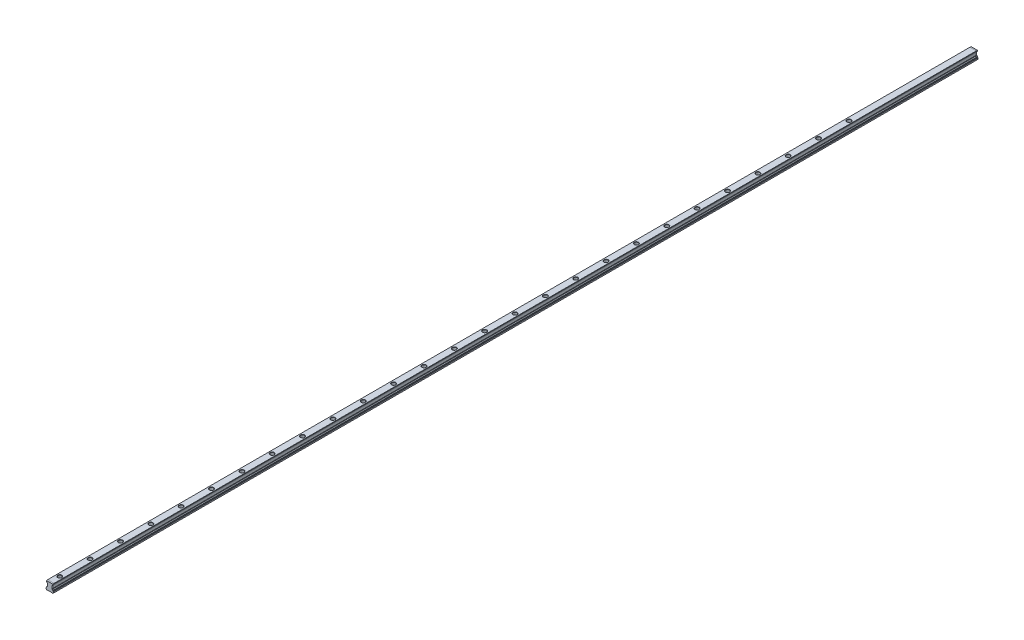
from build123d import *

# Parameters (mm, degrees)
BOSS_EXTRUDE1_DEPTH        = 911.5
BOSS_EXTRUDE2_DEPTH        = 2.5
BOSS_EXTRUDE2_DRAFT        = 7
MIRROR1_COPY_1_DEPTH       = 2.5
MIRROR1_COPY_1_DRAFT       = 7
SKETCH5_R                  = 2.25
CUT_EXTRUDE1_DEPTH         = 915.1754833
CHAMFER1_SIZE              = 0.5
LPATTERN1_COUNT            = 27
LPATTERN1_PITCH            = 60
CHAMFER1_OF_LPATTERN1_SIZE = 0.5
SKETCH6_R                  = 3.7
CUT_EXTRUDE2_DEPTH         = 5.9
CHAMFER2_SIZE              = 0.5
LPATTERN2_COUNT            = 27
LPATTERN2_PITCH            = 60
CHAMFER2_OF_LPATTERN2_SIZE = 0.5


with BuildPart() as part:
    # Sketch3 → Boss-Extrude1 (new, symmetric)
    with BuildSketch(Plane.XY):
        with BuildLine():
            Line((6.440305418, -7.679083745), (7.640305418, -6.479083745))
            Line((7.640305418, -6.479083745), (7.640305418, -3.983228934))
            Line((7.640305418, -3.983228934), (6.940305418, -3.579083745))
            Line((6.940305418, -3.579083745), (6.940305418, -2.064642509))
            ThreePointArc((6.940305418, -2.064642509), (6.075261245, -1.652952937), (5.584764336, -0.830029788))
            Line((5.584764336, -0.830029788), (4.890305418, -0.429083745))
            Line((4.890305418, -0.429083745), (4.890305418, 4.770916255))
            Line((4.890305418, 4.770916255), (5.584764336, 5.171862298))
            ThreePointArc((5.584764336, 5.171862298), (6.075261245, 5.994785446), (6.940305418, 6.406475019))
            Line((6.940305418, 6.406475019), (6.940305418, 8.025941508))
            Line((6.940305418, 8.025941508), (6.445330671, 8.520916255))
            Line((6.445330671, 8.520916255), (-6.164719835, 8.520916255))
            Line((-6.164719835, 8.520916255), (-6.659694582, 8.025941508))
            Line((-6.659694582, 8.025941508), (-6.659694582, 6.406475019))
            ThreePointArc((-6.659694582, 6.406475019), (-5.794650408, 5.994785446), (-5.304153499, 5.171862298))
            Line((-5.304153499, 5.171862298), (-4.609694582, 4.770916255))
            Line((-4.609694582, 4.770916255), (-4.609694582, -0.429083745))
            Line((-4.609694582, -0.429083745), (-5.304153499, -0.830029788))
            ThreePointArc((-5.304153499, -0.830029788), (-5.794650408, -1.652952937), (-6.659694582, -2.064642509))
            Line((-6.659694582, -2.064642509), (-6.659694582, -3.579083745))
            Line((-6.659694582, -3.579083745), (-7.359694582, -3.983228934))
            Line((-7.359694582, -3.983228934), (-7.359694582, -6.479083745))
            Line((-7.359694582, -6.479083745), (-6.159694582, -7.679083745))
            Line((-6.159694582, -7.679083745), (-3.159694582, -7.679083745))
            Line((-3.159694582, -7.679083745), (-2.859694582, -7.379083745))
            Line((-2.859694582, -7.379083745), (3.140305418, -7.379083745))
            Line((3.140305418, -7.379083745), (3.440305418, -7.679083745))
            Line((3.440305418, -7.679083745), (6.440305418, -7.679083745))
        make_face()
    extrude(amount=BOSS_EXTRUDE1_DEPTH, both=True)


with BuildPart() as boss_extrude2_tool:
    # Sketch4 → Boss-Extrude2 (with draft: the straight prism first)
    with BuildSketch(Plane.XY.offset(911.5)):
        with BuildLine():
            Line((6.440305418, -7.679083745), (7.640305418, -6.479083745))
            Line((7.640305418, -6.479083745), (7.640305418, -3.983228934))
            Line((7.640305418, -3.983228934), (6.940305418, -3.579083745))
            Line((6.940305418, -3.579083745), (6.940305418, -2.064642509))
            ThreePointArc((6.940305418, -2.064642509), (6.075261245, -1.652952937), (5.584764336, -0.830029788))
            Line((5.584764336, -0.830029788), (4.890305418, -0.429083745))
            Line((4.890305418, -0.429083745), (4.890305418, 4.770916255))
            Line((4.890305418, 4.770916255), (5.584764336, 5.171862298))
            ThreePointArc((5.584764336, 5.171862298), (6.075261245, 5.994785446), (6.940305418, 6.406475019))
            Line((6.940305418, 6.406475019), (6.940305418, 8.025941508))
            Line((6.940305418, 8.025941508), (6.445330671, 8.520916255))
            Line((6.445330671, 8.520916255), (-6.164719835, 8.520916255))
            Line((-6.164719835, 8.520916255), (-6.659694582, 8.025941508))
            Line((-6.659694582, 8.025941508), (-6.659694582, 6.406475019))
            ThreePointArc((-6.659694582, 6.406475019), (-5.794650408, 5.994785446), (-5.304153499, 5.171862298))
            Line((-5.304153499, 5.171862298), (-4.609694582, 4.770916255))
            Line((-4.609694582, 4.770916255), (-4.609694582, -0.429083745))
            Line((-4.609694582, -0.429083745), (-5.304153499, -0.830029788))
            ThreePointArc((-5.304153499, -0.830029788), (-5.794650408, -1.652952937), (-6.659694582, -2.064642509))
            Line((-6.659694582, -2.064642509), (-6.659694582, -3.579083745))
            Line((-6.659694582, -3.579083745), (-7.359694582, -3.983228934))
            Line((-7.359694582, -3.983228934), (-7.359694582, -6.479083745))
            Line((-7.359694582, -6.479083745), (-6.159694582, -7.679083745))
            Line((-6.159694582, -7.679083745), (-3.159694582, -7.679083745))
            Line((-3.159694582, -7.679083745), (-2.859694582, -7.379083745))
            Line((-2.859694582, -7.379083745), (3.140305418, -7.379083745))
            Line((3.140305418, -7.379083745), (3.440305418, -7.679083745))
            Line((3.440305418, -7.679083745), (6.440305418, -7.679083745))
        make_face()
    extrude(amount=BOSS_EXTRUDE2_DEPTH)
    # Boss-Extrude2: the draft: its side faces are tilted about the plane it starts from
    boss_extrude2_sides = [boss_extrude2_tool.faces().sort_by_distance(p)[0] for p in [
        (7.040305418, -7.079083745, 912.75),
        (7.640305418, -5.231156339, 912.75),
        (7.290305418, -3.781156339, 912.75),
        (6.940305418, -2.821863127, 912.75),
        (6.075261245, -1.652952937, 912.75),
        (5.237534877, -0.629556767, 912.75),
        (4.890305418, 2.170916255, 912.75),
        (5.237534877, 4.971389276, 912.75),
        (6.075261245, 5.994785446, 912.75),
        (6.940305418, 7.216208263, 912.75),
        (6.692818045, 8.273428881, 912.75),
        (0.140305418, 8.520916255, 912.75),
        (-6.412207208, 8.273428881, 912.75),
        (-6.659694582, 7.216208263, 912.75),
        (-5.794650408, 5.994785446, 912.75),
        (-4.95692404, 4.971389276, 912.75),
        (-4.609694582, 2.170916255, 912.75),
        (-4.95692404, -0.629556767, 912.75),
        (-5.794650408, -1.652952937, 912.75),
        (-6.659694582, -2.821863127, 912.75),
        (-7.009694582, -3.781156339, 912.75),
        (-7.359694582, -5.231156339, 912.75),
        (-6.759694582, -7.079083745, 912.75),
        (-4.659694582, -7.679083745, 912.75),
        (-3.009694582, -7.529083745, 912.75),
        (0.140305418, -7.379083745, 912.75),
        (3.290305418, -7.529083745, 912.75),
        (4.940305418, -7.679083745, 912.75),
    ]]
    draft(boss_extrude2_sides, Plane.XY.offset(911.5), BOSS_EXTRUDE2_DRAFT)


with BuildPart() as part_1:
    add(part.part)

    # Boss-Extrude2: add boss_extrude2_tool
    add(boss_extrude2_tool.part)


with BuildPart() as mirror1_copy_1_tool:
    # Mirror1 copy 1 sketch → Mirror1 copy 1 (with draft: the straight prism first)
    with BuildSketch(Plane(origin=(0, 0, -911.5), x_dir=(1, 0, 0), z_dir=(0, 0, -1))):
        with BuildLine():
            Line((6.440305418, 7.679083745), (7.640305418, 6.479083745))
            Line((7.640305418, 6.479083745), (7.640305418, 3.983228934))
            Line((7.640305418, 3.983228934), (6.940305418, 3.579083745))
            Line((6.940305418, 3.579083745), (6.940305418, 2.064642509))
            ThreePointArc((6.940305418, 2.064642509), (6.075261245, 1.652952937), (5.584764336, 0.830029788))
            Line((5.584764336, 0.830029788), (4.890305418, 0.429083745))
            Line((4.890305418, 0.429083745), (4.890305418, -4.770916255))
            Line((4.890305418, -4.770916255), (5.584764336, -5.171862298))
            ThreePointArc((5.584764336, -5.171862298), (6.075261245, -5.994785446), (6.940305418, -6.406475019))
            Line((6.940305418, -6.406475019), (6.940305418, -8.025941508))
            Line((6.940305418, -8.025941508), (6.445330671, -8.520916255))
            Line((6.445330671, -8.520916255), (-6.164719835, -8.520916255))
            Line((-6.164719835, -8.520916255), (-6.659694582, -8.025941508))
            Line((-6.659694582, -8.025941508), (-6.659694582, -6.406475019))
            ThreePointArc((-6.659694582, -6.406475019), (-5.794650408, -5.994785446), (-5.304153499, -5.171862298))
            Line((-5.304153499, -5.171862298), (-4.609694582, -4.770916255))
            Line((-4.609694582, -4.770916255), (-4.609694582, 0.429083745))
            Line((-4.609694582, 0.429083745), (-5.304153499, 0.830029788))
            ThreePointArc((-5.304153499, 0.830029788), (-5.794650408, 1.652952937), (-6.659694582, 2.064642509))
            Line((-6.659694582, 2.064642509), (-6.659694582, 3.579083745))
            Line((-6.659694582, 3.579083745), (-7.359694582, 3.983228934))
            Line((-7.359694582, 3.983228934), (-7.359694582, 6.479083745))
            Line((-7.359694582, 6.479083745), (-6.159694582, 7.679083745))
            Line((-6.159694582, 7.679083745), (-3.159694582, 7.679083745))
            Line((-3.159694582, 7.679083745), (-2.859694582, 7.379083745))
            Line((-2.859694582, 7.379083745), (3.140305418, 7.379083745))
            Line((3.140305418, 7.379083745), (3.440305418, 7.679083745))
            Line((3.440305418, 7.679083745), (6.440305418, 7.679083745))
        make_face()
    extrude(amount=MIRROR1_COPY_1_DEPTH)
    # Mirror1 copy 1: the draft: its side faces are tilted about the plane it starts from
    mirror1_copy_1_sides = [mirror1_copy_1_tool.faces().sort_by_distance(p)[0] for p in [
        (7.040305418, -7.079083745, -912.75),
        (7.640305418, -5.231156339, -912.75),
        (7.290305418, -3.781156339, -912.75),
        (6.940305418, -2.821863127, -912.75),
        (6.075261245, -1.652952937, -912.75),
        (5.237534877, -0.629556767, -912.75),
        (4.890305418, 2.170916255, -912.75),
        (5.237534877, 4.971389276, -912.75),
        (6.075261245, 5.994785446, -912.75),
        (6.940305418, 7.216208263, -912.75),
        (6.692818045, 8.273428881, -912.75),
        (0.140305418, 8.520916255, -912.75),
        (-6.412207208, 8.273428881, -912.75),
        (-6.659694582, 7.216208263, -912.75),
        (-5.794650408, 5.994785446, -912.75),
        (-4.95692404, 4.971389276, -912.75),
        (-4.609694582, 2.170916255, -912.75),
        (-4.95692404, -0.629556767, -912.75),
        (-5.794650408, -1.652952937, -912.75),
        (-6.659694582, -2.821863127, -912.75),
        (-7.009694582, -3.781156339, -912.75),
        (-7.359694582, -5.231156339, -912.75),
        (-6.759694582, -7.079083745, -912.75),
        (-4.659694582, -7.679083745, -912.75),
        (-3.009694582, -7.529083745, -912.75),
        (0.140305418, -7.379083745, -912.75),
        (3.290305418, -7.529083745, -912.75),
        (4.940305418, -7.679083745, -912.75),
    ]]
    draft(mirror1_copy_1_sides, Plane(origin=(0, 0, -911.5), x_dir=(1, 0, 0), z_dir=(0, 0, -1)), MIRROR1_COPY_1_DRAFT)


with BuildPart() as part_2:
    add(part_1.part)

    # Mirror1 copy 1: add mirror1_copy_1_tool
    add(mirror1_copy_1_tool.part)

    # Sketch5 → Cut-Extrude1 (cut, through all)
    with BuildSketch(Plane(origin=(0, 8.520916255, 0), x_dir=(1, 0, 0), z_dir=(0, 1, 0))):
        with Locations(Location((0.140305418, -894, 0), (0, 0, 270))):
            Circle(SKETCH5_R)
    cut_extrude1 = extrude(amount=-CUT_EXTRUDE1_DEPTH, mode=Mode.SUBTRACT)

    # Chamfer1
    chamfer1_edges = [part_2.edges().sort_by_distance(p)[0] for p in [
        (0.140305418, -7.379083745, 891.75),
    ]]
    chamfer(chamfer1_edges, length=CHAMFER1_SIZE)

    # LPattern1: Cut-Extrude1 ×27
    with Locations(*[(0, 0, -i * LPATTERN1_PITCH) for i in range(1, LPATTERN1_COUNT)]):
        add(cut_extrude1, mode=Mode.SUBTRACT)

    # Chamfer1 of LPattern1
    chamfer1_of_lpattern1_edges = [part_2.edges().sort_by_distance(p)[0] for p in [
        (0.140305418, -7.379083745, 831.75),
        (0.140305418, -7.379083745, 771.75),
        (0.140305418, -7.379083745, 711.75),
        (0.140305418, -7.379083745, 651.75),
        (0.140305418, -7.379083745, 591.75),
        (0.140305418, -7.379083745, 531.75),
        (0.140305418, -7.379083745, 471.75),
        (0.140305418, -7.379083745, 411.75),
        (0.140305418, -7.379083745, 351.75),
        (0.140305418, -7.379083745, 291.75),
        (0.140305418, -7.379083745, 231.75),
        (0.140305418, -7.379083745, 171.75),
        (0.140305418, -7.379083745, 111.75),
        (0.140305418, -7.379083745, 51.75),
        (0.140305418, -7.379083745, -8.25),
        (0.140305418, -7.379083745, -68.25),
        (0.140305418, -7.379083745, -128.25),
        (0.140305418, -7.379083745, -188.25),
        (0.140305418, -7.379083745, -248.25),
        (0.140305418, -7.379083745, -308.25),
        (0.140305418, -7.379083745, -368.25),
        (0.140305418, -7.379083745, -428.25),
        (0.140305418, -7.379083745, -488.25),
        (0.140305418, -7.379083745, -548.25),
        (0.140305418, -7.379083745, -608.25),
        (0.140305418, -7.379083745, -668.25),
    ]]
    chamfer(chamfer1_of_lpattern1_edges, length=CHAMFER1_OF_LPATTERN1_SIZE)

    # Sketch6 → Cut-Extrude2 (cut)
    with BuildSketch(Plane(origin=(0, 8.520916255, 0), x_dir=(1, 0, 0), z_dir=(0, 1, 0))):
        with Locations(Location((0.140305418, -894, 0), (0, 0, 270))):
            Circle(SKETCH6_R)
    cut_extrude2 = extrude(amount=-CUT_EXTRUDE2_DEPTH, mode=Mode.SUBTRACT)

    # Chamfer2
    chamfer2_edges = [part_2.edges().sort_by_distance(p)[0] for p in [
        (0.140305418, 8.520916255, 890.3),
    ]]
    chamfer(chamfer2_edges, length=CHAMFER2_SIZE)

    # LPattern2: Cut-Extrude2 ×27
    with Locations(*[(0, 0, -i * LPATTERN2_PITCH) for i in range(1, LPATTERN2_COUNT)]):
        add(cut_extrude2, mode=Mode.SUBTRACT)

    # Chamfer2 of LPattern2
    chamfer2_of_lpattern2_edges = [part_2.edges().sort_by_distance(p)[0] for p in [
        (0.140305418, 8.520916255, 830.3),
        (0.140305418, 8.520916255, 770.3),
        (0.140305418, 8.520916255, 710.3),
        (0.140305418, 8.520916255, 650.3),
        (0.140305418, 8.520916255, 590.3),
        (0.140305418, 8.520916255, 530.3),
        (0.140305418, 8.520916255, 470.3),
        (0.140305418, 8.520916255, 410.3),
        (0.140305418, 8.520916255, 350.3),
        (0.140305418, 8.520916255, 290.3),
        (0.140305418, 8.520916255, 230.3),
        (0.140305418, 8.520916255, 170.3),
        (0.140305418, 8.520916255, 110.3),
        (0.140305418, 8.520916255, 50.3),
        (0.140305418, 8.520916255, -9.7),
        (0.140305418, 8.520916255, -69.7),
        (0.140305418, 8.520916255, -129.7),
        (0.140305418, 8.520916255, -189.7),
        (0.140305418, 8.520916255, -249.7),
        (0.140305418, 8.520916255, -309.7),
        (0.140305418, 8.520916255, -369.7),
        (0.140305418, 8.520916255, -429.7),
        (0.140305418, 8.520916255, -489.7),
        (0.140305418, 8.520916255, -549.7),
        (0.140305418, 8.520916255, -609.7),
        (0.140305418, 8.520916255, -669.7),
    ]]
    chamfer(chamfer2_of_lpattern2_edges, length=CHAMFER2_OF_LPATTERN2_SIZE)


solid = part_2.part
